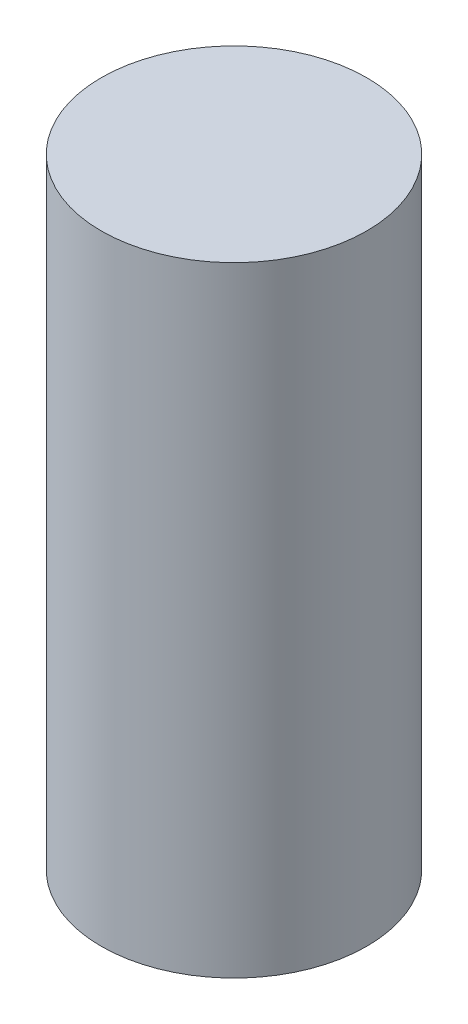
from build123d import *

# Parameters (mm, degrees)
PACK_AYAR_MIL_1_START = 12
SKETCH1_R             = 6
PACK_AYAR_MIL_1_DEPTH = 28


with BuildPart() as part:
    # Sketch1 → PACK_ayar_mil_1 (new body)
    with BuildSketch(Plane(origin=(0, 0, 0), x_dir=(1, 0, 0), z_dir=(0, 1, 0)).offset(PACK_AYAR_MIL_1_START)):
        with Locations(Location((50, 50, 0), (0, 0, 270))):
            Circle(SKETCH1_R)
    extrude(amount=PACK_AYAR_MIL_1_DEPTH)


solid = part.part
